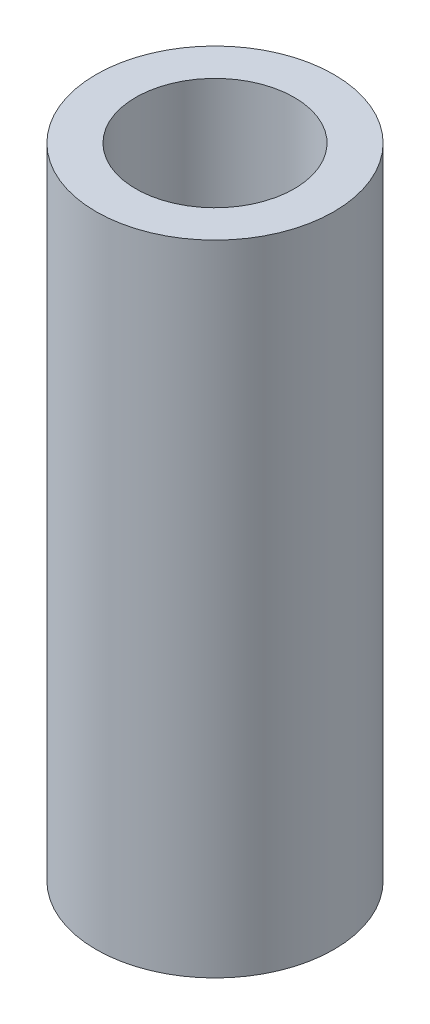
from build123d import *

# Parameters (mm, degrees)
SKETCH_1_R      = 2.4
SKETCH_1_R_2    = 1.6
EXTRUDE_1_DEPTH = 12.9


with BuildPart() as part:
    # Эскиз1 → Бобышка-Вытянуть1 (new body)
    with BuildSketch(Plane(origin=(0, 0, 0), x_dir=(1, 0, 0), z_dir=(0, 1, 0))):
        with Locations(Location((0, 0, 0), (0, 0, 90))):
            Circle(SKETCH_1_R)
        with Locations(Location((0, 0, 0), (0, 0, 90))):
            Circle(SKETCH_1_R_2, mode=Mode.SUBTRACT)
    extrude(amount=EXTRUDE_1_DEPTH)


solid = part.part
